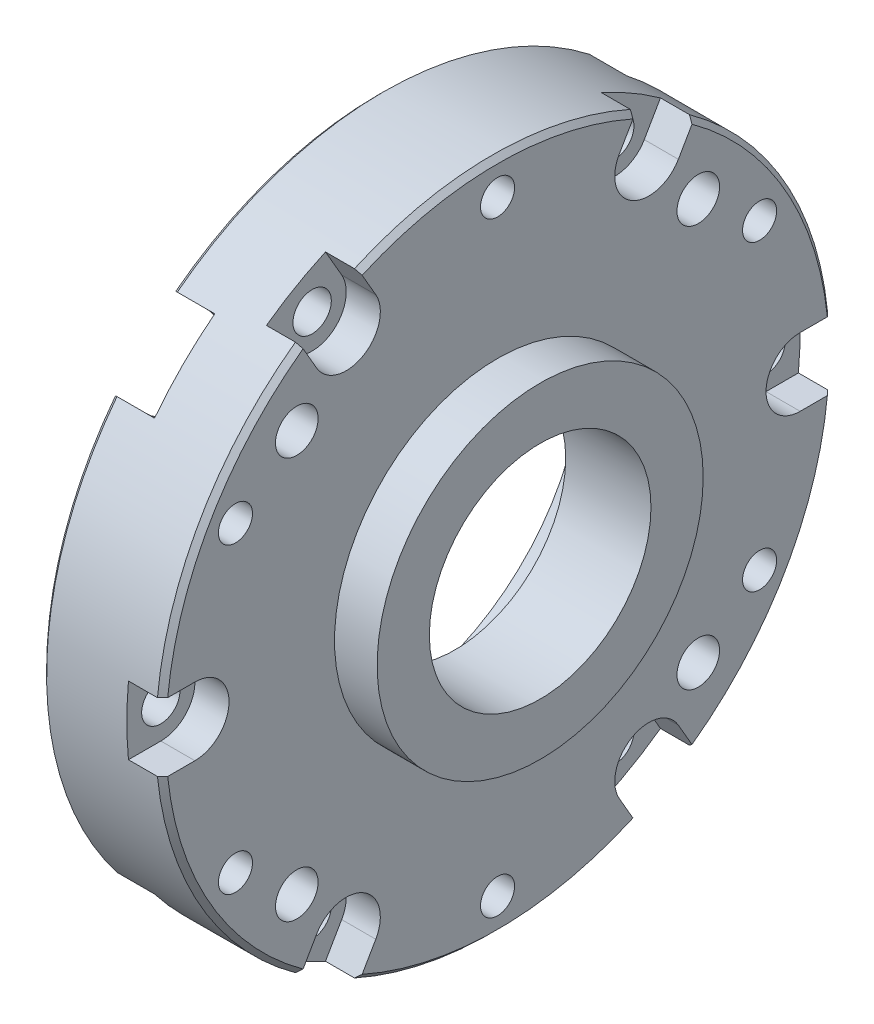
from build123d import *

# Parameters (mm, degrees)
SKETCH_1_R          = 39.5
EXTRUDE_1_DEPTH     = 14
SKETCH_2_R          = 2.25
SKETCH_2_R_2        = 2
CUT_EXTRUDE_1_DEPTH = 16
CUT_EXTRUDE_2_DEPTH = 4
CUT_EXTRUDE_3_DEPTH = 4
SKETCH_8_R          = 24.05
CUT_EXTRUDE_4_DEPTH = 9
SKETCH_9_R          = 2.5
CUT_EXTRUDE_5_DEPTH = 15
SKETCH_10_R         = 19.125
EXTRUDE_2_DEPTH     = 5
SKETCH_11_R         = 13
CUT_EXTRUDE_6_DEPTH = 104
CUT_EXTRUDE_7_DEPTH = 5
CHAMFER_2_SIZE      = 0.6
CHAMFER_3_SIZE      = 0.6
CHAMFER_4_SIZE      = 0.6
CHAMFER_5_SIZE      = 0.6
CHAMFER_6_SIZE      = 0.6
CHAMFER_7_SIZE      = 0.6
CHAMFER_9_SIZE      = 0.6
CHAMFER_10_SIZE     = 0.6
CHAMFER_11_SIZE     = 0.6
CHAMFER_12_SIZE     = 0.6


with BuildPart() as part:
    # 草图1 → 凸台-拉伸1 (new body)
    with BuildSketch(Plane(origin=(0, 0, 0), x_dir=(0, 0, -1), z_dir=(1, 0, 0))):
        Circle(SKETCH_1_R)
    extrude(amount=EXTRUDE_1_DEPTH)

    # 草图2 → 切除-拉伸1 (cut)
    with BuildSketch(Plane.ZY):
        with Locations((-35.5, 0)):
            Circle(SKETCH_2_R)
        with Locations((-30.743901834, 17.75)):
            Circle(SKETCH_2_R_2)
        with Locations((-17.75, 30.743901834)):
            Circle(SKETCH_2_R)
        with Locations((0, 35.5)):
            Circle(SKETCH_2_R_2)
        with Locations((17.75, 30.743901834)):
            Circle(SKETCH_2_R)
        with Locations((30.743901834, 17.75)):
            Circle(SKETCH_2_R_2)
        with Locations((35.5, 0)):
            Circle(SKETCH_2_R)
        with Locations((30.743901834, -17.75)):
            Circle(SKETCH_2_R_2)
        with Locations((17.75, -30.743901834)):
            Circle(SKETCH_2_R)
        with Locations((0, -35.5)):
            Circle(SKETCH_2_R_2)
        with Locations((-17.75, -30.743901834)):
            Circle(SKETCH_2_R)
        with Locations((-30.743901834, -17.75)):
            Circle(SKETCH_2_R_2)
    extrude(amount=-CUT_EXTRUDE_1_DEPTH, mode=Mode.SUBTRACT)

    # 草图4 → 切除-拉伸2 (cut)
    with BuildSketch(Plane(origin=(14, 0, 0), x_dir=(0, 0, -1), z_dir=(1, 0, 0))):
        with BuildLine():
            Line((-35.5, 4), (-44.201093629, 4))
            Line((-44.201093629, 4), (-44.201093629, -4))
            Line((-44.201093629, -4), (-35.5, -4))
            ThreePointArc((-35.5, -4), (-31.5, 0), (-35.5, 4))
        make_face()
    extrude(amount=-CUT_EXTRUDE_2_DEPTH, mode=Mode.SUBTRACT)

    # 草图7 → 切除-拉伸3 (cut)
    with BuildSketch(Plane(origin=(14, 0, 0), x_dir=(0, 0, -1), z_dir=(1, 0, 0))):
        with BuildLine():
            Line((-21.214101615, -28.743901834), (-24.616312288, -34.636703577))
            Line((-24.616312288, -34.636703577), (-17.688109058, -38.636703577))
            Line((-17.688109058, -38.636703577), (-14.285898385, -32.743901834))
            ThreePointArc((-14.285898385, -32.743901834), (-15.75, -27.279800219), (-21.214101615, -28.743901834))
        make_face()
        with BuildLine():
            Line((14.285898385, -32.743901834), (17.598294891, -38.481140877))
            Line((17.598294891, -38.481140877), (24.526498121, -34.481140877))
            Line((24.526498121, -34.481140877), (21.214101615, -28.743901834))
            ThreePointArc((21.214101615, -28.743901834), (15.75, -27.279800219), (14.285898385, -32.743901834))
        make_face()
        with BuildLine():
            Line((35.5, -4), (41.305115607, -4))
            Line((41.305115607, -4), (41.305115607, 4))
            Line((41.305115607, 4), (35.5, 4))
            ThreePointArc((35.5, 4), (31.5, 0), (35.5, -4))
        make_face()
        with BuildLine():
            Line((21.214101615, 28.743901834), (23.957184481, 33.495060727))
            Line((23.957184481, 33.495060727), (17.02898125, 37.495060727))
            Line((17.02898125, 37.495060727), (14.285898385, 32.743901834))
            ThreePointArc((14.285898385, 32.743901834), (15.75, 27.279800219), (21.214101615, 28.743901834))
        make_face()
        with BuildLine():
            Line((-14.285898385, 32.743901834), (-17.02898125, 37.495060727))
            Line((-17.02898125, 37.495060727), (-23.957184481, 33.495060727))
            Line((-23.957184481, 33.495060727), (-21.214101615, 28.743901834))
            ThreePointArc((-21.214101615, 28.743901834), (-15.75, 27.279800219), (-14.285898385, 32.743901834))
        make_face()
    extrude(amount=-CUT_EXTRUDE_3_DEPTH, mode=Mode.SUBTRACT)

    # 草图8 → 切除-拉伸4 (cut)
    with BuildSketch(Plane.ZY):
        Circle(SKETCH_8_R)
    extrude(amount=-CUT_EXTRUDE_4_DEPTH, mode=Mode.SUBTRACT)

    # 草图9 → 切除-拉伸5 (cut)
    with BuildSketch(Plane(origin=(14, 0, 0), x_dir=(0, 0, -1), z_dir=(1, 0, 0))):
        with Locations((23.55, -23.55)):
            Circle(SKETCH_9_R)
        with Locations((-23.55, -23.55)):
            Circle(SKETCH_9_R)
        with Locations((-23.55, 23.55)):
            Circle(SKETCH_9_R)
        with Locations((23.55, 23.55)):
            Circle(SKETCH_9_R)
    extrude(amount=-CUT_EXTRUDE_5_DEPTH, mode=Mode.SUBTRACT)

    # 草图10 → 凸台-拉伸2 (add)
    with BuildSketch(Plane(origin=(14, 0, 0), x_dir=(0, 0, -1), z_dir=(1, 0, 0))):
        Circle(SKETCH_10_R)
    extrude(amount=EXTRUDE_2_DEPTH)

    # 草图11 → 切除-拉伸6 (cut)
    with BuildSketch(Plane(origin=(19, 0, 0), x_dir=(0, 0, -1), z_dir=(1, 0, 0))):
        Circle(SKETCH_11_R)
    extrude(amount=-CUT_EXTRUDE_6_DEPTH, mode=Mode.SUBTRACT)

    # 草图12 → 切除-拉伸7 (cut)
    with BuildSketch(Plane.ZY):
        with BuildLine():
            Line((20.014466094, -27.085533906), (26.013985292, -33.085053103))
            Line((26.013985292, -33.085053103), (33.085053103, -26.013985292))
            Line((33.085053103, -26.013985292), (27.085533906, -20.014466094))
            ThreePointArc((27.085533906, -20.014466094), (20.014466094, -20.014466094), (20.014466094, -27.085533906))
        make_face()
        with BuildLine():
            Line((27.085533906, 20.014466094), (32.930330591, 25.859262779))
            Line((32.930330591, 25.859262779), (25.859262779, 32.930330591))
            Line((25.859262779, 32.930330591), (20.014466094, 27.085533906))
            ThreePointArc((20.014466094, 27.085533906), (20.014466094, 20.014466094), (27.085533906, 20.014466094))
        make_face()
        with BuildLine():
            Line((-20.014466094, 27.085533906), (-27.290112032, 34.361179844))
            Line((-27.290112032, 34.361179844), (-34.361179844, 27.290112032))
            Line((-34.361179844, 27.290112032), (-27.085533906, 20.014466094))
            ThreePointArc((-27.085533906, 20.014466094), (-20.014466094, 20.014466094), (-20.014466094, 27.085533906))
        make_face()
        with BuildLine():
            Line((-27.085533906, -20.014466094), (-33.971209247, -26.900141436))
            Line((-33.971209247, -26.900141436), (-26.900141436, -33.971209247))
            Line((-26.900141436, -33.971209247), (-20.014466094, -27.085533906))
            ThreePointArc((-20.014466094, -27.085533906), (-20.014466094, -20.014466094), (-27.085533906, -20.014466094))
        make_face()
    extrude(amount=-CUT_EXTRUDE_7_DEPTH, mode=Mode.SUBTRACT)

    # 倒角2
    chamfer_2_edges = [part.edges().sort_by_distance(p)[0] for p in [
        (0, 12.771209477, -37.378419021),
    ]]
    chamfer(chamfer_2_edges, length=CHAMFER_2_SIZE)

    # 倒角3
    chamfer_3_edges = [part.edges().sort_by_distance(p)[0] for p in [
        (0, -39.5, 0),
    ]]
    chamfer(chamfer_3_edges, length=CHAMFER_3_SIZE)

    # 倒角4
    chamfer_4_edges = [part.edges().sort_by_distance(p)[0] for p in [
        (0, 0, 39.5),
    ]]
    chamfer(chamfer_4_edges, length=CHAMFER_4_SIZE)

    # 倒角5
    chamfer_5_edges = [part.edges().sort_by_distance(p)[0] for p in [
        (0, 39.5, 0),
    ]]
    chamfer(chamfer_5_edges, length=CHAMFER_5_SIZE)

    # 倒角6
    chamfer_6_edges = [part.edges().sort_by_distance(p)[0] for p in [
        (14, 19.75, -34.208003449),
    ]]
    chamfer(chamfer_6_edges, length=CHAMFER_6_SIZE)

    # 倒角7
    chamfer_7_edges = [part.edges().sort_by_distance(p)[0] for p in [
        (14, 39.5, 0),
    ]]
    chamfer(chamfer_7_edges, length=CHAMFER_7_SIZE)

    # 倒角9
    chamfer_9_edges = [part.edges().sort_by_distance(p)[0] for p in [
        (14, -19.75, -34.208003449),
    ]]
    chamfer(chamfer_9_edges, length=CHAMFER_9_SIZE)

    # 倒角10
    chamfer_10_edges = [part.edges().sort_by_distance(p)[0] for p in [
        (14, -39.5, 0),
    ]]
    chamfer(chamfer_10_edges, length=CHAMFER_10_SIZE)

    # 倒角11
    chamfer_11_edges = [part.edges().sort_by_distance(p)[0] for p in [
        (14, -19.75, 34.208003449),
    ]]
    chamfer(chamfer_11_edges, length=CHAMFER_11_SIZE)

    # 倒角12
    chamfer_12_edges = [part.edges().sort_by_distance(p)[0] for p in [
        (14, 19.75, 34.208003449),
    ]]
    chamfer(chamfer_12_edges, length=CHAMFER_12_SIZE)


solid = part.part
